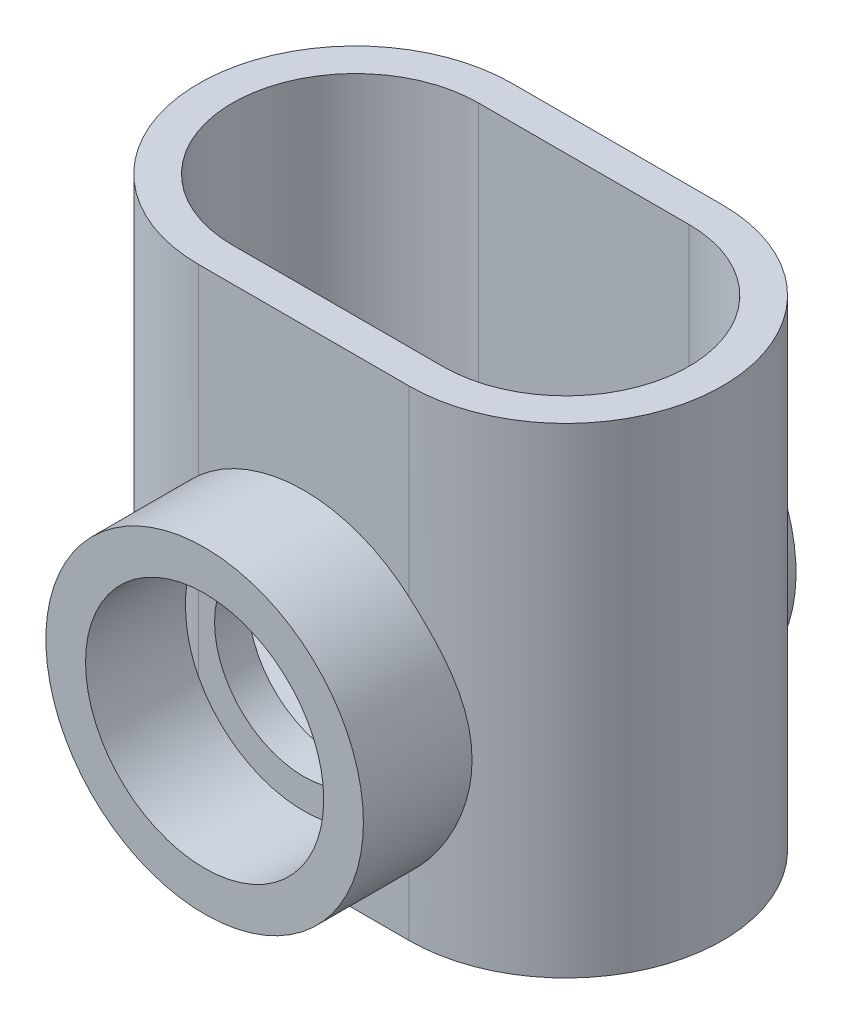
from build123d import *

# Parameters (mm, degrees)
EXTRUDE_1_DEPTH     = 24.2
SHELL_1_T           = -1.7
EXTRUDE_2_REACH     = 38.885
SKETCH_2_R          = 8
SKETCH_2_R_2        = 6
SKETCH_3_R          = 4.5
CUT_EXTRUDE_1_DEPTH = 35.315157171
SKETCH_4_R          = 8
SKETCH_4_R_2        = 4.5
EXTRUDE_3_DEPTH     = 1


with BuildPart() as part:
    # 草圖1 → 填料-伸長1 (new body)
    with BuildSketch(Plane(origin=(0, 0, 0), x_dir=(1, 0, 0), z_dir=(0, 1, 0))):
        with BuildLine():
            Line((0, 7.9), (10.6, 7.9))
            ThreePointArc((10.6, 7.9), (18.5, 0), (10.6, -7.9))
            Line((10.6, -7.9), (0, -7.9))
            ThreePointArc((0, -7.9), (-7.9, 0), (0, 7.9))
        make_face()
    extrude(amount=EXTRUDE_1_DEPTH)

    # 薄殼1
    shell_1_openings = [part.faces().sort_by_distance(p)[0] for p in [
        (5.3, 24.2, 0),
    ]]
    offset(amount=SHELL_1_T, openings=shell_1_openings, kind=Kind.INTERSECTION)

    # 草圖2 → 填料-伸長2 (add, up to next)
    with BuildSketch(Plane.XY.offset(12.9), mode=Mode.PRIVATE) as extrude_2_sk1:
        with Locations((5.3, 9)):
            Circle(SKETCH_2_R)
        with Locations((5.3, 9)):
            Circle(SKETCH_2_R_2, mode=Mode.SUBTRACT)
    extrude_2_tool1 = extrude(extrude_2_sk1.sketch, amount=-EXTRUDE_2_REACH, mode=Mode.PRIVATE) - part.part
    add(extrude_2_tool1.solids().sort_by_distance((-2.473726, 9, 12.9))[0])

    # 草圖3 → 除料-伸長1 (cut, through all)
    with BuildSketch(Plane.XY.offset(7.9)):
        with Locations((5.3, 9)):
            Circle(SKETCH_3_R)
    extrude(amount=-CUT_EXTRUDE_1_DEPTH, mode=Mode.SUBTRACT)

    # 草圖4 → 填料-伸長3 (add)
    with BuildSketch(Plane(origin=(0, 0, -7.9), x_dir=(-1, 0, 0), z_dir=(0, 0, -1))):
        with Locations(Location((-5.3, 9, 0), (0, 0, 180))):
            Circle(SKETCH_4_R)
        with Locations(Location((-5.3, 9, 0), (0, 0, 180))):
            Circle(SKETCH_4_R_2, mode=Mode.SUBTRACT)
    extrude(amount=EXTRUDE_3_DEPTH)


solid = part.part
